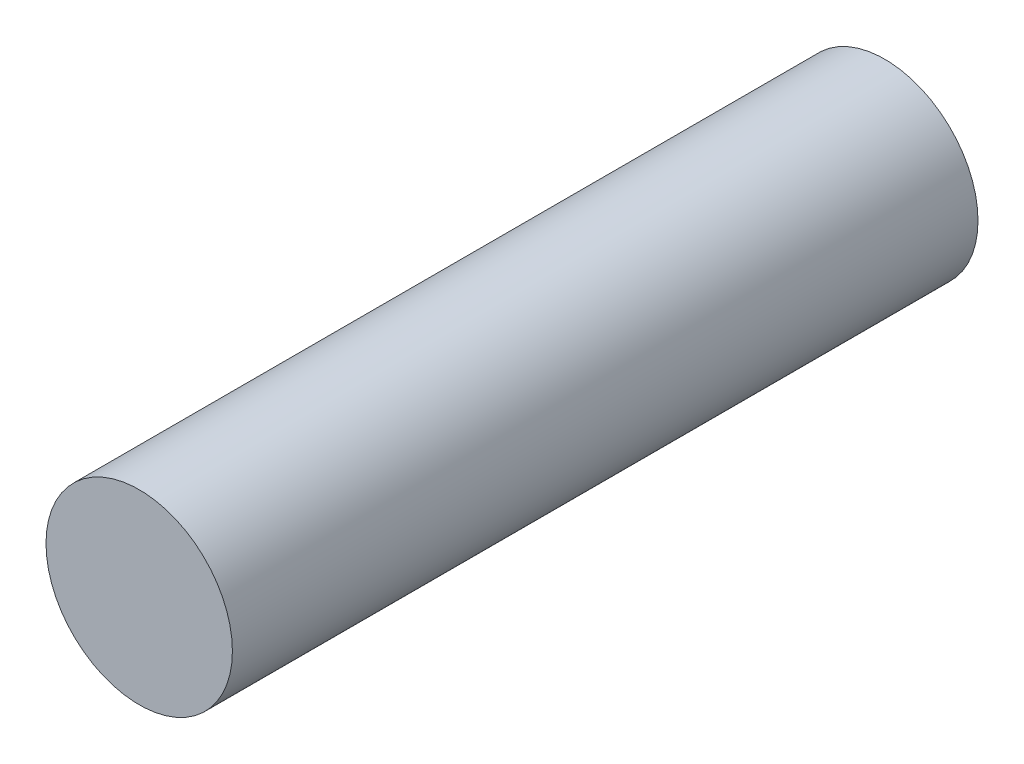
from build123d import *

# Parameters (mm, degrees)
SKETCH1_R           = 6.35
BOSS_EXTRUDE1_DEPTH = 25.4


with BuildPart() as part:
    # Sketch1 → Boss-Extrude1 (new, symmetric)
    with BuildSketch(Plane.XY):
        Circle(SKETCH1_R)
    extrude(amount=BOSS_EXTRUDE1_DEPTH, both=True)


solid = part.part
